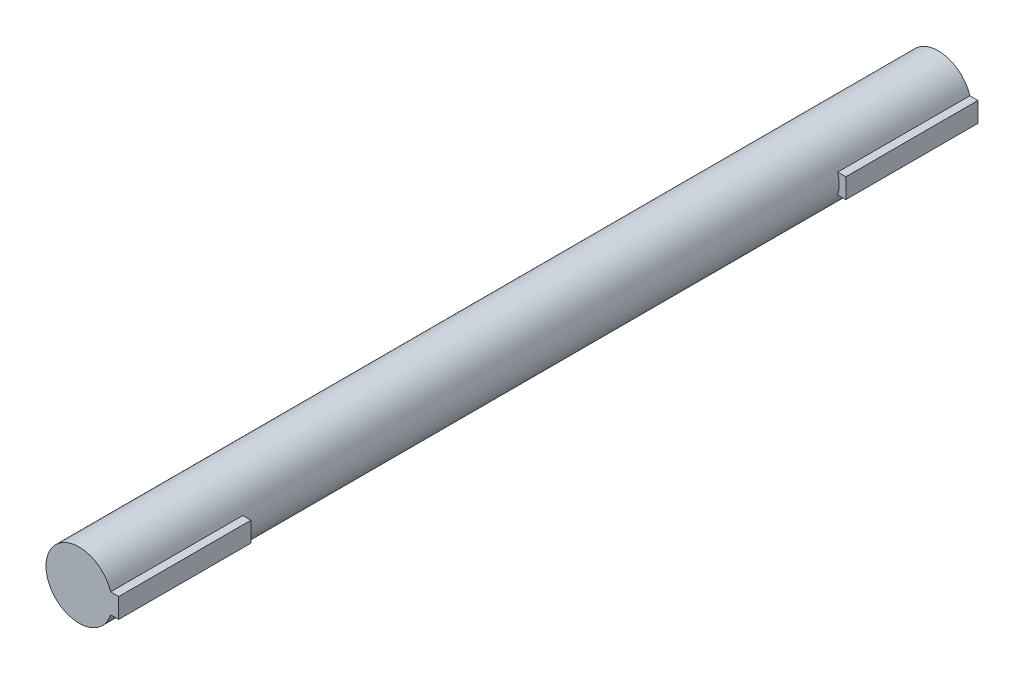
from build123d import *

# Parameters (mm, degrees)
SKETCH2_R           = 10
BOSS_EXTRUDE5_DEPTH = 260
SKETCH5_W           = 12
SKETCH5_H           = 6
BOSS_EXTRUDE6_DEPTH = 40
SKETCH6_W           = 12
SKETCH6_H           = 6
BOSS_EXTRUDE7_DEPTH = 40


with BuildPart() as part:
    # Sketch2 → Boss-Extrude5 (new body)
    with BuildSketch(Plane.XY):
        Circle(SKETCH2_R)
    extrude(amount=BOSS_EXTRUDE5_DEPTH)

    # Sketch5 → Boss-Extrude6 (add)
    with BuildSketch(Plane.XY.offset(260)):
        with Locations((6, 0)):
            Rectangle(SKETCH5_W, SKETCH5_H)
    extrude(amount=-BOSS_EXTRUDE6_DEPTH)

    # Sketch6 → Boss-Extrude7 (add)
    with BuildSketch(Plane(origin=(0, 0, 0), x_dir=(-1, 0, 0), z_dir=(0, 0, -1))):
        with Locations((-6, 0)):
            Rectangle(SKETCH6_W, SKETCH6_H)
    extrude(amount=-BOSS_EXTRUDE7_DEPTH)


solid = part.part
